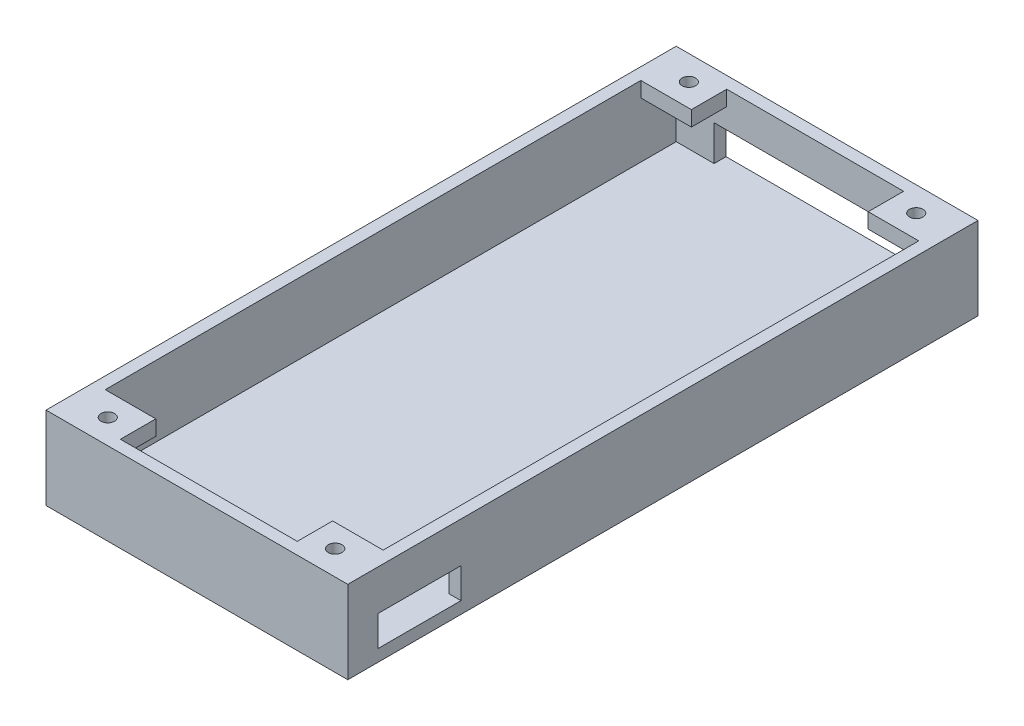
from build123d import *

# Parameters (mm, degrees)
SKETCH1_W               = 75.85
SKETCH1_H               = 158.4
BOSS_EXTRUDE1_DEPTH     = 3
SKETCH2_W               = 75.85
SKETCH2_H               = 158.4
SKETCH2_W_2             = 69.85
SKETCH2_H_2             = 152.4
BOSS_EXTRUDE2_DEPTH     = 17.78
SKETCH3_W               = 12.7
SKETCH3_H               = 8.89
BOSS_EXTRUDE3_DEPTH     = 3.81
SKETCH7_W               = 50.8
SKETCH7_H               = 42.7
BOSS_EXTRUDE4_DEPTH     = 6.35
CUT_EXTRUDE2_DEPTH      = 110.455089078
CUT_EXTRUDE2_DEPTH_BACK = 110.455089078
CUT_EXTRUDE3_START      = -6.35
SKETCH9_W               = 22.86
SKETCH9_H               = 9.7
CUT_EXTRUDE3_DEPTH      = 6.35
CUT_EXTRUDE4_REACH      = 93.907
SKETCH4_R               = 1.7
SKETCH4_R_2             = 1.72
CUT_EXTRUDE5_REACH      = 166.197
SKETCH10_W              = 50.8
SKETCH10_H              = 8.89
CUT_EXTRUDE6_REACH      = 113.614
SKETCH11_W              = 20.828
SKETCH11_H              = 7.62


with BuildPart() as part:
    # Sketch1 → Boss-Extrude1 (new body)
    with BuildSketch(Plane(origin=(0, 0, 0), x_dir=(1, 0, 0), z_dir=(0, 1, 0))):
        Rectangle(SKETCH1_W, SKETCH1_H)
    extrude(amount=BOSS_EXTRUDE1_DEPTH)

    # Sketch2 → Boss-Extrude2 (add)
    with BuildSketch(Plane(origin=(0, 3, 0), x_dir=(1, 0, 0), z_dir=(0, 1, 0))):
        Rectangle(SKETCH2_W, SKETCH2_H)
        Rectangle(SKETCH2_W_2, SKETCH2_H_2, mode=Mode.SUBTRACT)
    extrude(amount=BOSS_EXTRUDE2_DEPTH)

    # Sketch3 → Boss-Extrude3 (add)
    with BuildSketch(Plane(origin=(0, 20.78, 0), x_dir=(1, 0, 0), z_dir=(0, 1, 0))):
        with Locations((-28.575, 71.755)):
            Rectangle(SKETCH3_W, SKETCH3_H)
        with Locations((-28.575, -71.755)):
            Rectangle(SKETCH3_W, SKETCH3_H)
        with Locations((28.575, 71.755)):
            Rectangle(SKETCH3_W, SKETCH3_H)
        with Locations((28.575, -71.755)):
            Rectangle(SKETCH3_W, SKETCH3_H)
    extrude(amount=-BOSS_EXTRUDE3_DEPTH)

    # Sketch7 → Boss-Extrude4 (add)
    with BuildSketch(Plane.XZ):
        Rectangle(SKETCH7_W, SKETCH7_H)
    extrude(amount=BOSS_EXTRUDE4_DEPTH)

    # Sketch8 → Cut-Extrude2 (cut, two sides: drawn at the far end of the back side and taken through both)
    with BuildSketch(Plane.XY.offset(21.35).offset(-CUT_EXTRUDE2_DEPTH_BACK)):
        Polygon((-3.81, -3.175), (-3.81, 0), (-25.4, 0), (-25.4, -6.35), (-11.43, -6.35), (-11.43, -3.175), align=None)
        Polygon((25.4, 0), (3.81, 0), (3.81, -3.175), (11.43, -3.175), (11.43, -6.35), (25.4, -6.35), align=None)
    extrude(amount=CUT_EXTRUDE2_DEPTH + CUT_EXTRUDE2_DEPTH_BACK, mode=Mode.SUBTRACT)

    # Sketch9 → Cut-Extrude3 (cut)
    with BuildSketch(Plane.XZ.offset(6.35).offset(CUT_EXTRUDE3_START)):
        with Locations((0, 16.5)):
            Rectangle(SKETCH9_W, SKETCH9_H)
    extrude(amount=CUT_EXTRUDE3_DEPTH, mode=Mode.SUBTRACT)

    # Sketch4 → Cut-Extrude4 (cut, up to next)
    with BuildSketch(Plane(origin=(0, 20.78, 0), x_dir=(1, 0, 0), z_dir=(0, 1, 0)), mode=Mode.PRIVATE) as cut_extrude4_sk1:
        with Locations(Location((-28.575, 73.025, 0), (0, 0, 270))):
            Circle(SKETCH4_R)
    cut_extrude4_tool1 = extrude(cut_extrude4_sk1.sketch, amount=-CUT_EXTRUDE4_REACH, mode=Mode.PRIVATE) & part.part
    # Sketch4 → Cut-Extrude4 (cut, up to next)
    with BuildSketch(Plane(origin=(0, 20.78, 0), x_dir=(1, 0, 0), z_dir=(0, 1, 0)), mode=Mode.PRIVATE) as cut_extrude4_sk2:
        with Locations(Location((28.575, 73.025, 0), (0, 0, 270))):
            Circle(SKETCH4_R)
    cut_extrude4_tool2 = extrude(cut_extrude4_sk2.sketch, amount=-CUT_EXTRUDE4_REACH, mode=Mode.PRIVATE) & part.part
    # Sketch4 → Cut-Extrude4 (cut, up to next)
    with BuildSketch(Plane(origin=(0, 20.78, 0), x_dir=(1, 0, 0), z_dir=(0, 1, 0)), mode=Mode.PRIVATE) as cut_extrude4_sk3:
        with Locations(Location((28.575, -73.025, 0), (0, 0, 270))):
            Circle(SKETCH4_R_2)
    cut_extrude4_tool3 = extrude(cut_extrude4_sk3.sketch, amount=-CUT_EXTRUDE4_REACH, mode=Mode.PRIVATE) & part.part
    # Sketch4 → Cut-Extrude4 (cut, up to next)
    with BuildSketch(Plane(origin=(0, 20.78, 0), x_dir=(1, 0, 0), z_dir=(0, 1, 0)), mode=Mode.PRIVATE) as cut_extrude4_sk4:
        with Locations(Location((-28.575, -73.025, 0), (0, 0, 270))):
            Circle(SKETCH4_R)
    cut_extrude4_tool4 = extrude(cut_extrude4_sk4.sketch, amount=-CUT_EXTRUDE4_REACH, mode=Mode.PRIVATE) & part.part
    add(cut_extrude4_tool1.solids().sort_by_distance((-28.575, 20.78, -73.025))[0], mode=Mode.SUBTRACT)
    add(cut_extrude4_tool2.solids().sort_by_distance((28.575, 20.78, -73.025))[0], mode=Mode.SUBTRACT)
    add(cut_extrude4_tool3.solids().sort_by_distance((28.575, 20.78, 73.025))[0], mode=Mode.SUBTRACT)
    add(cut_extrude4_tool4.solids().sort_by_distance((-28.575, 20.78, 73.025))[0], mode=Mode.SUBTRACT)

    # Sketch10 → Cut-Extrude5 (cut, up to next)
    with BuildSketch(Plane(origin=(0, 0, -79.2), x_dir=(-1, 0, 0), z_dir=(0, 0, -1)), mode=Mode.PRIVATE) as cut_extrude5_sk1:
        with Locations((0, 7.445)):
            Rectangle(SKETCH10_W, SKETCH10_H)
    cut_extrude5_tool1 = extrude(cut_extrude5_sk1.sketch, amount=-CUT_EXTRUDE5_REACH, mode=Mode.PRIVATE) & part.part
    add(cut_extrude5_tool1.solids().sort_by_distance((0, 7.445, -79.2))[0], mode=Mode.SUBTRACT)

    # Sketch11 → Cut-Extrude6 (cut, up to next)
    with BuildSketch(Plane(origin=(37.925, 0, 0), x_dir=(0, 0, -1), z_dir=(1, 0, 0)), mode=Mode.PRIVATE) as cut_extrude6_sk1:
        with Locations((-61.166, 6.81)):
            Rectangle(SKETCH11_W, SKETCH11_H)
    cut_extrude6_tool1 = extrude(cut_extrude6_sk1.sketch, amount=-CUT_EXTRUDE6_REACH, mode=Mode.PRIVATE) & part.part
    add(cut_extrude6_tool1.solids().sort_by_distance((37.925, 6.81, 61.166))[0], mode=Mode.SUBTRACT)


solid = part.part
